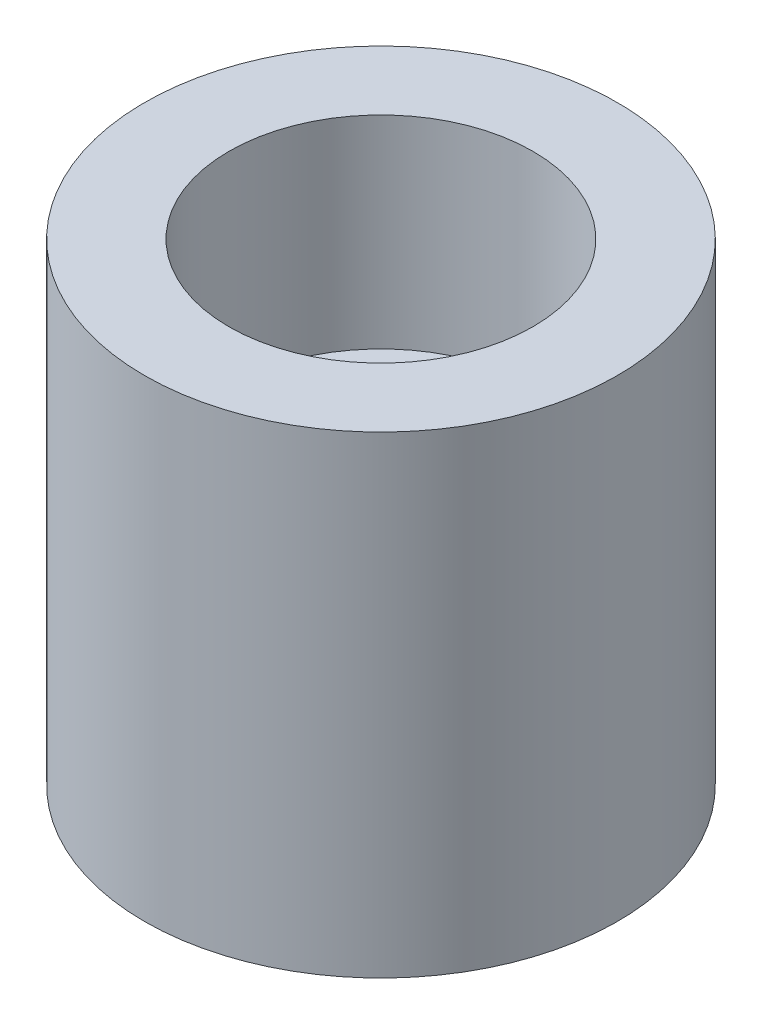
from build123d import *

# Parameters (mm, degrees)
CROQUIS1_R              = 3.5
SALIENTE_EXTRUIR1_DEPTH = 7
CROQUIS2_R              = 2.25
CORTAR_EXTRUIR1_DEPTH   = 3
CORTAR_EXTRUIR2_START   = -1.5
CROQUIS3_R              = 2.25
CORTAR_EXTRUIR2_DEPTH   = 1.5


with BuildPart() as part:
    # Croquis1 → Saliente-Extruir1 (new body)
    with BuildSketch(Plane(origin=(0, 0, 0), x_dir=(1, 0, 0), z_dir=(0, 1, 0))):
        with Locations(Location((0, 0, 0), (0, 0, 270))):
            Circle(CROQUIS1_R)
    extrude(amount=SALIENTE_EXTRUIR1_DEPTH)

    # Croquis2 → Cortar-Extruir1 (cut)
    with BuildSketch(Plane(origin=(0, 7, 0), x_dir=(1, 0, 0), z_dir=(0, 1, 0))):
        with Locations(Location((0, 0, 0), (0, 0, 270))):
            Circle(CROQUIS2_R)
    extrude(amount=-CORTAR_EXTRUIR1_DEPTH, mode=Mode.SUBTRACT)

    # Croquis3 → Cortar-Extruir2 (cut)
    with BuildSketch(Plane.XZ.offset(CORTAR_EXTRUIR2_START)):
        with Locations(Location((0, 0, 0), (0, 0, 90))):
            Circle(CROQUIS3_R)
    extrude(amount=CORTAR_EXTRUIR2_DEPTH, mode=Mode.SUBTRACT)


solid = part.part
